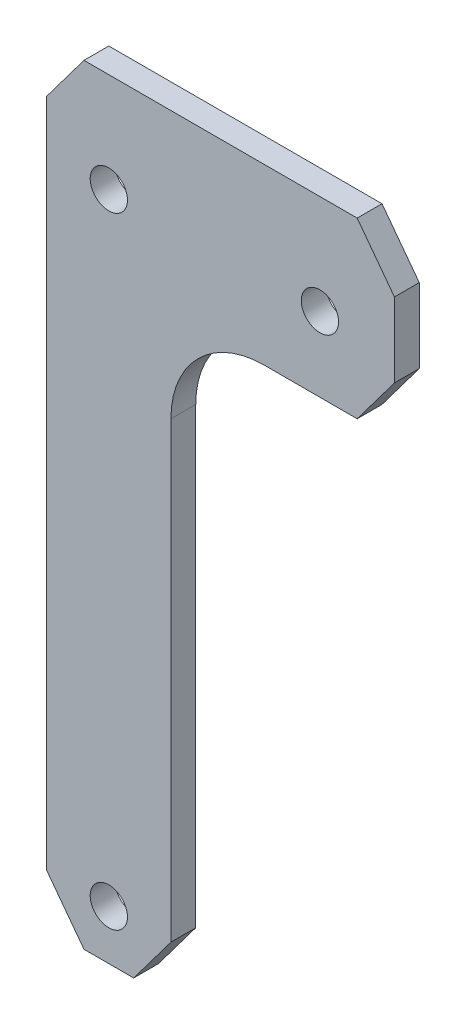
from build123d import *

# Parameters (mm, degrees)
ESTRUSIONE_ESTRUSIONE1_DEPTH = 2
TAGLIO_ESTRUSIONE1_DEPTH     = 69.058798109
SCHIZZO3_R                   = 1.5
TAGLIO_ESTRUSIONE3_DEPTH     = 69.058798109
ESTRUSIONE_ESTRUSIONE2_DEPTH = 2


with BuildPart() as part:
    # Schizzo1 → Estrusione-Estrusione1 (new body)
    with BuildSketch(Plane.XY):
        Polygon((0, 0), (0, -62), (10, -62), (10, -14), (28, -14), (28, 0), align=None)
    extrude(amount=-ESTRUSIONE_ESTRUSIONE1_DEPTH)

    # Schizzo2 → Taglio-Estrusione1 (cut, through all)
    with BuildSketch(Plane.XY):
        Polygon((3, -62), (0, -58), (0, -62), align=None)
        Polygon((10, -58), (7, -62), (10, -62), align=None)
        Polygon((0, -4), (3, 0), (0, 0), align=None)
        Polygon((25, 0), (28, 0), (28, -4), align=None)
        Polygon((28, -14), (25, -14), (28, -10), align=None)
    extrude(amount=-TAGLIO_ESTRUSIONE1_DEPTH, mode=Mode.SUBTRACT)

    # Schizzo3 → Taglio-Estrusione3 (cut, through all)
    with BuildSketch(Plane.XY):
        with Locations((5, -8)):
            Circle(SCHIZZO3_R)
        with Locations((22, -8)):
            Circle(SCHIZZO3_R)
        with Locations((5, -58)):
            Circle(SCHIZZO3_R)
    extrude(amount=-TAGLIO_ESTRUSIONE3_DEPTH, mode=Mode.SUBTRACT)

    # Schizzo4 → Estrusione-Estrusione2 (add)
    with BuildSketch(Plane.XY):
        with BuildLine():
            Line((10, -21.5), (10, -14))
            Line((10, -14), (17.5, -14))
            ThreePointArc((17.5, -14), (12.196699141, -16.196699141), (10, -21.5))
        make_face()
    extrude(amount=-ESTRUSIONE_ESTRUSIONE2_DEPTH)


solid = part.part
